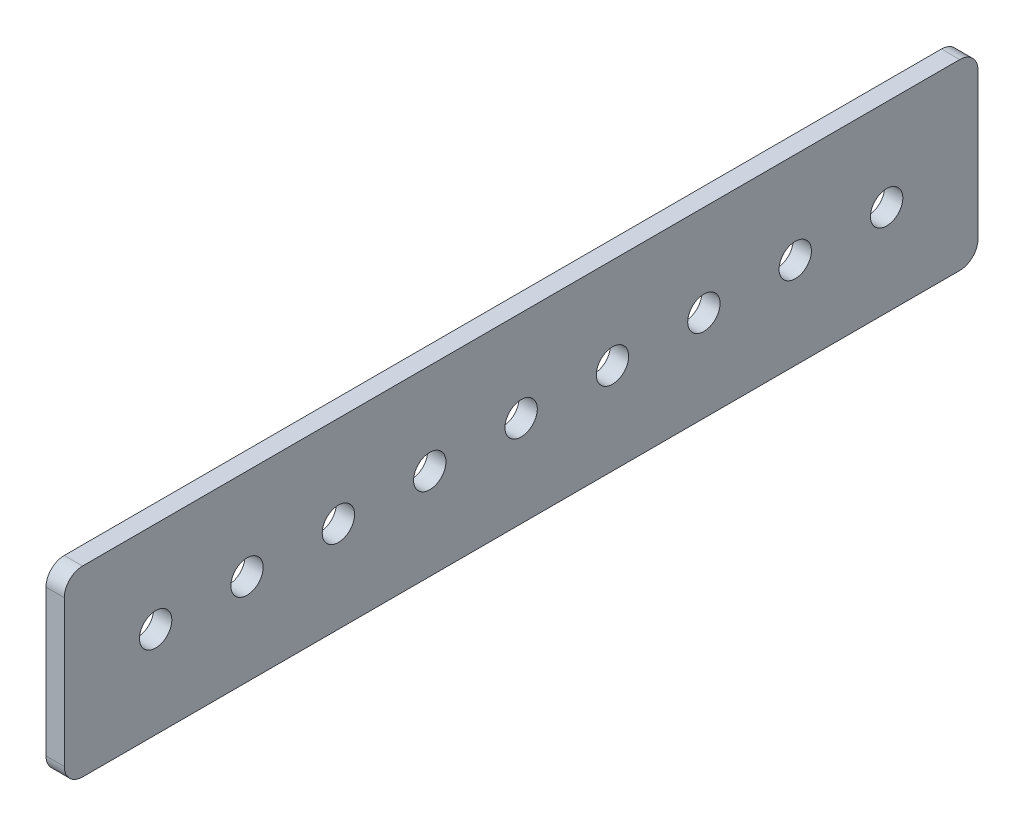
from build123d import *

# Parameters (mm, degrees)
SKETCH1_W             = 127
SKETCH1_H             = 25.4
BOSS_EXTRUDE1_DEPTH   = 2.54
F_8_CLEARANCE_HOLE1_D = 4.4958
FILLET1_R             = 2.54


with BuildPart() as part:
    # Sketch1 → Boss-Extrude1 (new body)
    with BuildSketch(Plane(origin=(0, 0, 0), x_dir=(0, 0, -1), z_dir=(1, 0, 0))):
        with Locations((0, -11.049)):
            Rectangle(SKETCH1_W, SKETCH1_H)
    extrude(amount=BOSS_EXTRUDE1_DEPTH)

    # #8 Clearance Hole1 (through all)
    with Locations(Plane.ZY):
        with Locations((-50.8, -11.049), (-25.4, -11.049), (-38.1, -11.049), (0, -11.049), (25.4, -11.049), (50.8, -11.049), (-12.7, -11.049), (12.7, -11.049), (38.1, -11.049)):
            Hole(F_8_CLEARANCE_HOLE1_D / 2)

    # Fillet1
    fillet1_edges = [part.edges().sort_by_distance(p)[0] for p in [
        (1.27, -23.749, 63.5),
        (1.27, 1.651, 63.5),
        (1.27, 1.651, -63.5),
        (1.27, -23.749, -63.5),
    ]]
    fillet(fillet1_edges, radius=FILLET1_R)


solid = part.part
